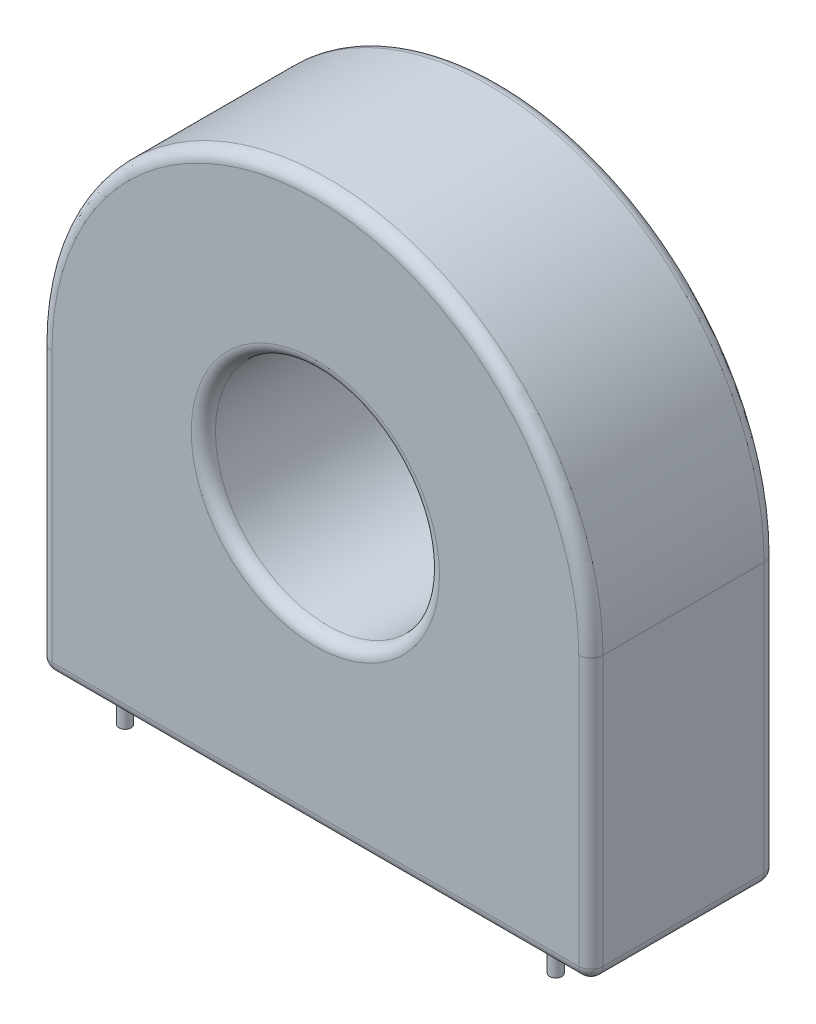
from build123d import *

# Parameters (mm, degrees)
SKETCH1_R           = 9.25
BOSS_EXTRUDE1_DEPTH = 7.65
SKETCH2_R           = 0.5
BOSS_EXTRUDE2_DEPTH = 2.5
FILLET1_R           = 1
SKETCH3_W           = 0.895944424
SKETCH3_H           = 4
SKETCH3_W_2         = 1.965215774
SKETCH3_H_2         = 0.500882695
CUT_EXTRUDE1_DEPTH  = 0.01
SKETCH4_W           = 0.682539037
SKETCH4_H           = 0.809522518
SKETCH4_H_2         = 0.809522517
CUT_EXTRUDE2_DEPTH  = 0.01


with BuildPart() as part:
    # Sketch1 → Boss-Extrude1 (new, symmetric)
    with BuildSketch(Plane.XY):
        with BuildLine():
            Line((-22.75, 11.625), (-22.75, -11.625))
            Line((-22.75, -11.625), (22.75, -11.625))
            Line((22.75, -11.625), (22.75, 11.625))
            ThreePointArc((22.75, 11.625), (0, 34.375), (-22.75, 11.625))
        make_face()
        with Locations((0, 11.625)):
            Circle(SKETCH1_R, mode=Mode.SUBTRACT)
    extrude(amount=BOSS_EXTRUDE1_DEPTH, both=True)

    # Sketch2 → Boss-Extrude2 (add, symmetric)
    with BuildSketch(Plane.XZ.offset(11.625)):
        with Locations(Location((17.78, 5.58, 0), (0, 0, 90))):
            Circle(SKETCH2_R)
        with Locations(Location((0, -4.58, 0), (0, 0, 90))):
            Circle(SKETCH2_R)
        with Locations(Location((-17.78, 5.58, 0), (0, 0, 90))):
            Circle(SKETCH2_R)
    extrude(amount=BOSS_EXTRUDE2_DEPTH, both=True)

    # Fillet1
    fillet1_edges = [part.edges().sort_by_distance(p)[0] for p in [
        (-9.25, 11.625, 7.65),
        (-22.75, 0, 7.65),
        (0, -11.625, 7.65),
        (22.75, 0, 7.65),
        (0, -11.625, -7.65),
        (-22.75, 0, -7.65),
        (0, 34.375, -7.65),
        (22.75, 0, -7.65),
        (22.75, -11.625, 0),
        (-22.75, -11.625, 0),
        (0, 34.375, 7.65),
    ]]
    fillet(fillet1_edges, radius=FILLET1_R)

    # Sketch3 → Cut-Extrude1 (cut)
    # profile 1 of 17: a face of its own
    with BuildSketch(Plane.XY.offset(-7.65)):
        Polygon((-8.243385382, -3.852442817), (-9.139329806, -3.852442817), (-9.139329806, -0.943216627), (-11.623966601, -3.852442817), (-12.582009721, -3.852442817), (-12.582009721, 0.147557183), (-11.686065297, 0.147557183), (-11.686065297, -2.761482996), (-9.201445726, 0.147557183), (-8.243385382, 0.147557183), align=None)
    # profile 2 of 17: a face of its own
    with BuildSketch(Plane.XY.offset(-7.65)):
        with Locations((-7.393297629, -1.852442817)):
            Rectangle(SKETCH3_W, SKETCH3_H)
    # profile 3 of 17: a face of its own
    with BuildSketch(Plane.XY.offset(-7.65)):
        Polygon((-2.768958574, -3.852441956), (-6.834476962, -3.852441956), (-6.834476962, -3.351560122), (-3.664902998, -3.351560122), (-3.664902998, 0.147557183), (-2.768958574, 0.147557183), align=None)
    # profile 4 of 17: a face of its own
    with BuildSketch(Plane.XY.offset(-7.65)):
        with Locations((-0.282186518, -1.852442817)):
            Rectangle(SKETCH3_W, SKETCH3_H)
    # profile 5 of 17: a face of its own
    with BuildSketch(Plane.XY.offset(-7.65)):
        Polygon((5.244161293, -3.852442817), (4.329861111, -3.852442817), (3.769090333, -2.723695022), (1.66010458, -2.723695022), (1.099333802, -3.852442817), (0.18503362, -3.852442817), (2.19649402, 0.147557183), (3.232700893, 0.147557183), align=None)
        Polygon((3.506990947, -2.222812327), (2.714597456, -0.642503409), (1.922203965, -2.222812327), align=None, mode=Mode.SUBTRACT)
    # profile 6 of 17: a face of its own
    with BuildSketch(Plane.XY.offset(-7.65)):
        Polygon((9.590829785, -3.852442817), (8.694885362, -3.852442817), (8.694885362, -1.877134176), (6.14814987, -1.877134176), (6.14814987, -3.852442817), (5.252205447, -3.852442817), (5.252205447, 0.147557183), (6.14814987, 0.147557183), (6.14814987, -1.37625148), (8.694885362, -1.37625148), (8.694885362, 0.147557183), (9.590829785, 0.147557183), align=None)
    # profile 7 of 17: a face of its own
    with BuildSketch(Plane.XY.offset(-7.65)):
        Polygon((14.532518498, -0.353325513), (12.582011443, -0.353325513), (12.582011443, -3.852442817), (11.686067881, -3.852442817), (11.686067881, -0.353325513), (9.735560826, -0.353325513), (9.735560826, 0.147557183), (14.532518498, 0.147557183), align=None)
    # profile 8 of 17: a face of its own
    with BuildSketch(Plane.XY.offset(-7.65)):
        with BuildLine():
            add(Edge.make_bspline(
                [(-14.092768959, -8.387409611), (-14.093682359, -8.416798847), (-14.095444674, -8.473502486), (-14.107040039, -8.555298605), (-14.125683506, -8.631229451), (-14.151024529, -8.701754478), (-14.183558361, -8.767078187), (-14.224942542, -8.825300742), (-14.271907298, -8.879214637), (-14.326767489, -8.926585214), (-14.38808482, -8.967933996), (-14.454750326, -9.004373318), (-14.52729125, -9.03541708), (-14.606060265, -9.059642085), (-14.69033939, -9.079109265), (-14.780196049, -9.093183874), (-14.875991171, -9.100984664), (-14.941667322, -9.101946627), (-14.975485009, -9.102441956)],
                knots=[0, 0, 0, 0, 1.091324182, 2.105602559, 3.061388645, 3.990302777, 4.883708783, 5.761913066, 6.63583257, 7.533363956, 8.444729669, 9.377803759, 10.351071984, 11.369571165, 12.434066396, 13.5611468, 14.744196001, 16, 16, 16, 16], degree=3))
            Line((-14.975485009, -9.102441956), (-16.973509493, -9.102441956))
            add(Edge.make_bspline(
                [(-16.973509493, -9.102441956), (-17.007103675, -9.101941333), (-17.072556098, -9.100965956), (-17.168128459, -9.093184015), (-17.25798513, -9.079109231), (-17.342264241, -9.05964209), (-17.421033297, -9.03541709), (-17.493574078, -9.004373278), (-17.560240087, -8.96793414), (-17.621555608, -8.926584691), (-17.676422367, -8.879216537), (-17.723363266, -8.825293838), (-17.76483693, -8.767104304), (-17.797071266, -8.701561929), (-17.823788355, -8.631435435), (-17.842083583, -8.555267841), (-17.853747393, -8.473757651), (-17.855521593, -8.417298834), (-17.85643739, -8.388156242)],
                knots=[0, 0, 0, 0, 1.248585623, 2.432652029, 3.560701514, 4.626112014, 5.645486916, 6.619591972, 7.553468334, 8.465617653, 9.36392075, 10.238591664, 11.11755104, 12.011725211, 12.945218025, 13.90182591, 14.916976379, 16, 16, 16, 16], degree=3))
            Line((-17.85643739, -8.388156242), (-17.856440834, -5.817603477))
            add(Edge.make_bspline(
                [(-17.856440834, -5.817603477), (-17.855523491, -5.788462915), (-17.853746238, -5.732006206), (-17.842083798, -5.650497895), (-17.8237883, -5.574330315), (-17.797071279, -5.504203818), (-17.764836926, -5.438661443), (-17.723363267, -5.380471908), (-17.676422367, -5.32654921), (-17.621555608, -5.279181056), (-17.560240087, -5.237831606), (-17.493574078, -5.201392469), (-17.421033297, -5.170348655), (-17.342264241, -5.146123665), (-17.257985128, -5.126656481), (-17.168128465, -5.112581873), (-17.072333344, -5.104781083), (-17.006657193, -5.10381912), (-16.972839506, -5.103323791)],
                knots=[0, 0, 0, 0, 1.082394717, 2.097023559, 3.053139899, 3.986153045, 4.879867752, 5.758375482, 6.632596953, 7.530438465, 8.442119083, 9.37551558, 10.3491201, 11.367971205, 12.432834253, 13.560304098, 14.743762081, 16, 16, 16, 16], degree=3))
            Line((-16.972839506, -5.103323791), (-14.975689966, -5.102442817))
            add(Edge.make_bspline(
                [(-14.975689966, -5.102442817), (-14.941806362, -5.10331105), (-14.876074911, -5.104995352), (-14.780194387, -5.11252725), (-14.690339799, -5.126669955), (-14.606060162, -5.146120303), (-14.527291275, -5.170349507), (-14.45475032, -5.201392218), (-14.388084821, -5.237831805), (-14.326767488, -5.279180519), (-14.271907299, -5.326551114), (-14.22494254, -5.380465004), (-14.183558371, -5.43868756), (-14.151024493, -5.504011269), (-14.12568365, -5.574536294), (-14.107039472, -5.65046715), (-14.095481961, -5.73201659), (-14.093692588, -5.788469804), (-14.092768959, -5.817609505)],
                knots=[0, 0, 0, 0, 1.259172173, 2.442692089, 3.570220939, 4.635139714, 5.654044138, 6.627699609, 7.561144954, 8.472873283, 9.370761781, 10.245029003, 11.123582708, 12.017344185, 12.946627916, 13.902794293, 14.917476233, 16, 16, 16, 16], degree=3))
            Line((-14.092768959, -5.817609505), (-14.092768959, -8.387409611))
        make_face()
        with BuildLine():
            Line((-14.921694844, -8.418002541), (-14.921694844, -5.787010546))
            add(Edge.make_bspline(
                [(-14.921694844, -5.787010546), (-14.922552419, -5.772712006), (-14.924186458, -5.745467314), (-14.936173859, -5.707682312), (-14.953640843, -5.675085245), (-14.978500578, -5.648802462), (-15.009079361, -5.628002708), (-15.046310566, -5.614310691), (-15.089384151, -5.605145539), (-15.120343035, -5.604532632), (-15.13686067, -5.604205625)],
                knots=[0, 0, 0, 0, 1.068687892, 2.03629688, 2.942648866, 3.814683618, 4.718091592, 5.68670121, 6.765775135, 8, 8, 8, 8], degree=3))
            Line((-15.13686067, -5.604205625), (-16.811524126, -5.603325513))
            add(Edge.make_bspline(
                [(-16.811524126, -5.603325513), (-16.82802163, -5.604015565), (-16.858944314, -5.60530899), (-16.902236935, -5.614455591), (-16.939920748, -5.627778683), (-16.970720504, -5.648813863), (-16.995487187, -5.675102237), (-17.013313351, -5.707522083), (-17.023699745, -5.7458961), (-17.02619132, -5.773161473), (-17.027513228, -5.787627142)],
                knots=[0, 0, 0, 0, 1.229193561, 2.303982665, 3.289199236, 4.189019928, 5.057591977, 5.960344992, 6.917859159, 8, 8, 8, 8], degree=3))
            Line((-17.027513228, -5.787627142), (-17.02751495, -8.418002541))
            add(Edge.make_bspline(
                [(-17.02751495, -8.418002541), (-17.02619583, -8.432514035), (-17.023713126, -8.459826005), (-17.01331298, -8.498243414), (-16.995487323, -8.530664262), (-16.970720311, -8.556949177), (-16.939921439, -8.577998001), (-16.902234004, -8.591263307), (-16.858955334, -8.600660893), (-16.827986688, -8.60124727), (-16.811463845, -8.601560122)],
                knots=[0, 0, 0, 0, 1.085029602, 2.042125889, 2.944484921, 3.812677906, 4.712105896, 5.696892497, 6.771212539, 8, 8, 8, 8], degree=3))
            Line((-16.811463845, -8.601560122), (-15.137675333, -8.601560122))
            add(Edge.make_bspline(
                [(-15.137675333, -8.601560122), (-15.120884586, -8.601250355), (-15.089651388, -8.600674144), (-15.046310398, -8.591455672), (-15.009079392, -8.577762891), (-14.978500598, -8.55696333), (-14.953640732, -8.530680458), (-14.936174313, -8.498083577), (-14.924122164, -8.460101229), (-14.922532857, -8.432645352), (-14.921694844, -8.418002541)],
                knots=[0, 0, 0, 0, 1.248967675, 2.323258931, 3.287575479, 4.186979369, 5.05514909, 5.957483945, 6.920804297, 8, 8, 8, 8], degree=3))
        make_face(mode=Mode.SUBTRACT)
    # profile 9 of 17: a face of its own
    with BuildSketch(Plane.XY.offset(-7.65)):
        with BuildLine():
            add(Edge.make_bspline(
                [(-10.091358025, -8.387409611), (-10.092271424, -8.416798847), (-10.094033739, -8.473502486), (-10.105629104, -8.555298605), (-10.124272571, -8.631229451), (-10.149613594, -8.701754478), (-10.182147427, -8.767078187), (-10.223531608, -8.825300742), (-10.270496363, -8.879214637), (-10.325356554, -8.926585214), (-10.386673885, -8.967933996), (-10.453339391, -9.004373318), (-10.525880315, -9.03541708), (-10.60464933, -9.059642085), (-10.688928455, -9.079109265), (-10.778785114, -9.093183874), (-10.874580236, -9.100984664), (-10.940256387, -9.101946627), (-10.974074074, -9.102441956)],
                knots=[0, 0, 0, 0, 1.091324182, 2.105602559, 3.061388645, 3.990302777, 4.883708783, 5.761913066, 6.63583257, 7.533363956, 8.444729669, 9.377803759, 10.351071984, 11.369571165, 12.434066396, 13.5611468, 14.744196001, 16, 16, 16, 16], degree=3))
            Line((-10.974074074, -9.102441956), (-12.972098559, -9.102441956))
            add(Edge.make_bspline(
                [(-12.972098559, -9.102441956), (-13.00569274, -9.101941333), (-13.071145163, -9.100965956), (-13.166717524, -9.093184015), (-13.256574195, -9.079109231), (-13.340853306, -9.05964209), (-13.419622363, -9.03541709), (-13.492163143, -9.004373278), (-13.558829153, -8.96793414), (-13.620144673, -8.926584691), (-13.675011432, -8.879216537), (-13.721952331, -8.825293838), (-13.763425995, -8.767104304), (-13.795660331, -8.701561929), (-13.82237742, -8.631435435), (-13.840672649, -8.555267841), (-13.852336458, -8.473757651), (-13.854110658, -8.417298834), (-13.855026455, -8.388156242)],
                knots=[0, 0, 0, 0, 1.248585623, 2.432652029, 3.560701514, 4.626112014, 5.645486916, 6.619591972, 7.553468334, 8.465617653, 9.36392075, 10.238591664, 11.11755104, 12.011725211, 12.945218025, 13.90182591, 14.916976379, 16, 16, 16, 16], degree=3))
            Line((-13.855026455, -8.388156242), (-13.8550299, -5.817603477))
            add(Edge.make_bspline(
                [(-13.8550299, -5.817603477), (-13.854112557, -5.788462915), (-13.852335303, -5.732006206), (-13.840672863, -5.650497895), (-13.822377366, -5.574330315), (-13.795660345, -5.504203818), (-13.763425991, -5.438661443), (-13.721952332, -5.380471908), (-13.675011432, -5.32654921), (-13.620144673, -5.279181056), (-13.558829153, -5.237831606), (-13.492163143, -5.201392469), (-13.419622363, -5.170348655), (-13.340853307, -5.146123665), (-13.256574193, -5.126656481), (-13.16671753, -5.112581873), (-13.070922409, -5.104781083), (-13.005246258, -5.10381912), (-12.971428571, -5.103323791)],
                knots=[0, 0, 0, 0, 1.082394717, 2.097023559, 3.053139899, 3.986153045, 4.879867752, 5.758375482, 6.632596953, 7.530438465, 8.442119083, 9.37551558, 10.3491201, 11.367971205, 12.432834253, 13.560304098, 14.743762081, 16, 16, 16, 16], degree=3))
            Line((-12.971428571, -5.103323791), (-10.974279032, -5.102442817))
            add(Edge.make_bspline(
                [(-10.974279032, -5.102442817), (-10.940395427, -5.10331105), (-10.874663976, -5.104995352), (-10.778783452, -5.11252725), (-10.688928865, -5.126669955), (-10.604649228, -5.146120303), (-10.52588034, -5.170349507), (-10.453339385, -5.201392218), (-10.386673887, -5.237831805), (-10.325356553, -5.279180519), (-10.270496364, -5.326551114), (-10.223531605, -5.380465004), (-10.182147436, -5.43868756), (-10.149613558, -5.504011269), (-10.124272715, -5.574536294), (-10.105628537, -5.65046715), (-10.094071026, -5.73201659), (-10.092281653, -5.788469804), (-10.091358025, -5.817609505)],
                knots=[0, 0, 0, 0, 1.259172173, 2.442692089, 3.570220939, 4.635139714, 5.654044138, 6.627699609, 7.561144954, 8.472873283, 9.370761781, 10.245029003, 11.123582708, 12.017344185, 12.946627916, 13.902794293, 14.917476233, 16, 16, 16, 16], degree=3))
            Line((-10.091358025, -5.817609505), (-10.091358025, -8.387409611))
        make_face()
        with BuildLine():
            Line((-10.920283909, -8.418002541), (-10.920283909, -5.787010546))
            add(Edge.make_bspline(
                [(-10.920283909, -5.787010546), (-10.921141484, -5.772712006), (-10.922775523, -5.745467314), (-10.934762925, -5.707682312), (-10.952229908, -5.675085245), (-10.977089643, -5.648802462), (-11.007668426, -5.628002708), (-11.044899632, -5.614310691), (-11.087973216, -5.605145539), (-11.1189321, -5.604532632), (-11.135449735, -5.604205625)],
                knots=[0, 0, 0, 0, 1.068687892, 2.03629688, 2.942648866, 3.814683618, 4.718091592, 5.68670121, 6.765775135, 8, 8, 8, 8], degree=3))
            Line((-11.135449735, -5.604205625), (-12.810113192, -5.603325513))
            add(Edge.make_bspline(
                [(-12.810113192, -5.603325513), (-12.826610696, -5.604015565), (-12.857533379, -5.60530899), (-12.900826, -5.614455591), (-12.938509813, -5.627778683), (-12.969309569, -5.648813863), (-12.994076253, -5.675102237), (-13.011902417, -5.707522083), (-13.02228881, -5.7458961), (-13.024780385, -5.773161473), (-13.026102293, -5.787627142)],
                knots=[0, 0, 0, 0, 1.229193561, 2.303982665, 3.289199236, 4.189019928, 5.057591977, 5.960344992, 6.917859159, 8, 8, 8, 8], degree=3))
            Line((-13.026102293, -5.787627142), (-13.026104015, -8.418002541))
            add(Edge.make_bspline(
                [(-13.026104015, -8.418002541), (-13.024784896, -8.432514035), (-13.022302191, -8.459826005), (-13.011902045, -8.498243414), (-12.994076389, -8.530664262), (-12.969309376, -8.556949177), (-12.938510504, -8.577998001), (-12.900823069, -8.591263307), (-12.857544399, -8.600660893), (-12.826575753, -8.60124727), (-12.81005291, -8.601560122)],
                knots=[0, 0, 0, 0, 1.085029602, 2.042125889, 2.944484921, 3.812677906, 4.712105896, 5.696892497, 6.771212539, 8, 8, 8, 8], degree=3))
            Line((-12.81005291, -8.601560122), (-11.136264399, -8.601560122))
            add(Edge.make_bspline(
                [(-11.136264399, -8.601560122), (-11.119473651, -8.601250355), (-11.088240453, -8.600674144), (-11.044899463, -8.591455672), (-11.007668457, -8.577762891), (-10.977089664, -8.55696333), (-10.952229797, -8.530680458), (-10.934763379, -8.498083577), (-10.922711229, -8.460101229), (-10.921121922, -8.432645352), (-10.920283909, -8.418002541)],
                knots=[0, 0, 0, 0, 1.248967675, 2.323258931, 3.287575479, 4.186979369, 5.05514909, 5.957483945, 6.920804297, 8, 8, 8, 8], degree=3))
        make_face(mode=Mode.SUBTRACT)
    # profile 10 of 17: a face of its own
    with BuildSketch(Plane.XY.offset(-7.65)):
        Polygon((-6.747720493, -5.603325513), (-7.839507034, -5.603325513), (-7.839507034, -9.102442817), (-8.668432919, -9.102442817), (-8.668432919, -5.102442817), (-6.747720493, -5.102442817), align=None)
    # profile 11 of 17: a face of its own
    with BuildSketch(Plane.XY.offset(-7.65)):
        with Locations((-4.929806858, -7.441066726)):
            Rectangle(SKETCH3_W_2, SKETCH3_H_2)
    # profile 12 of 17: a face of its own
    with BuildSketch(Plane.XY.offset(-7.65)):
        with BuildLine():
            Line((-0.062433862, -9.102441956), (-2.943174396, -9.102441956))
            add(Edge.make_bspline(
                [(-2.943174396, -9.102441956), (-2.976768578, -9.101941333), (-3.042221001, -9.100965956), (-3.13779336, -9.093184015), (-3.227650038, -9.079109233), (-3.311929126, -9.059642082), (-3.390698265, -9.03541712), (-3.463238756, -9.004373172), (-3.529905784, -8.967934513), (-3.59121764, -8.926583343), (-3.646097698, -8.879221432), (-3.692990291, -8.825276058), (-3.734798666, -8.766957424), (-3.766268277, -8.701062772), (-3.793842135, -8.630980299), (-3.811573222, -8.554628837), (-3.823449348, -8.472886893), (-3.82519911, -8.416420771), (-3.826102293, -8.387274408)],
                knots=[0, 0, 0, 0, 1.247794276, 2.431110226, 3.558444758, 4.623180007, 5.641908834, 6.615396507, 7.548680983, 8.460252186, 9.357985943, 10.232102494, 11.11050479, 12.013864952, 12.936550513, 13.903155723, 14.917662794, 16, 16, 16, 16], degree=3))
            Line((-3.826102293, -8.387274408), (-3.826105737, -7.342130352))
            add(Edge.make_bspline(
                [(-3.826105737, -7.342130352), (-3.825194362, -7.313042769), (-3.823427062, -7.25663736), (-3.811620081, -7.174927589), (-3.793616474, -7.098392458), (-3.76672072, -7.028017), (-3.734505794, -6.962470097), (-3.693027214, -6.904281387), (-3.646087186, -6.850359776), (-3.59122188, -6.802986296), (-3.529899461, -6.76165761), (-3.463260618, -6.725137721), (-3.390529258, -6.694379354), (-3.31210164, -6.668858204), (-3.227716144, -6.649313706), (-3.137655444, -6.636986831), (-3.042063706, -6.627305701), (-2.976335586, -6.626609714), (-2.942504409, -6.62625148)],
                knots=[0, 0, 0, 0, 1.079603584, 2.093521595, 3.059565557, 3.99192505, 4.885013636, 5.762905899, 6.636514906, 7.533727405, 8.444769315, 9.377511891, 10.350434321, 11.371899559, 12.436016582, 13.561057118, 14.74464218, 16, 16, 16, 16], degree=3))
            Line((-2.942504409, -6.62625148), (-0.891359747, -6.62625148))
            Line((-0.891359747, -6.62625148), (-0.891359747, -5.603325513))
            Line((-0.891359747, -5.603325513), (-3.605051257, -5.603325513))
            Line((-3.605051257, -5.603325513), (-3.605051257, -5.102442817))
            Line((-3.605051257, -5.102442817), (-0.062433862, -5.102442817))
            Line((-0.062433862, -5.102442817), (-0.062433862, -7.127134176))
            Line((-0.062433862, -7.127134176), (-2.781189029, -7.127134176))
            add(Edge.make_bspline(
                [(-2.781189029, -7.127134176), (-2.797679997, -7.127833524), (-2.82859041, -7.129144371), (-2.871963862, -7.138180282), (-2.909228473, -7.151811502), (-2.940980804, -7.171619732), (-2.964826556, -7.198943809), (-2.983041164, -7.231267482), (-2.993346074, -7.269724557), (-2.995849785, -7.29697756), (-2.997178131, -7.311436665)],
                knots=[0, 0, 0, 0, 1.228569347, 2.302811313, 3.287526345, 4.174798407, 5.059089855, 5.961383309, 6.918410039, 8, 8, 8, 8], degree=3))
            Line((-2.997178131, -7.311436665), (-2.997179853, -8.417253326))
            add(Edge.make_bspline(
                [(-2.997179853, -8.417253326), (-2.995852085, -8.431715422), (-2.993349562, -8.458972994), (-2.983029314, -8.497407893), (-2.964868248, -8.529812795), (-2.940719274, -8.556964482), (-2.909540764, -8.577956677), (-2.871912747, -8.591275855), (-2.828616048, -8.600657094), (-2.797650133, -8.601245948), (-2.781128748, -8.601560122)],
                knots=[0, 0, 0, 0, 1.080018298, 2.035574722, 2.936481959, 3.819414846, 4.717395756, 5.700597943, 6.773189523, 8, 8, 8, 8], degree=3))
            Line((-2.781128748, -8.601560122), (-0.062433862, -8.601560122))
            Line((-0.062433862, -8.601560122), (-0.062433862, -9.102441956))
        make_face()
    # profile 13 of 17: a face of its own
    with BuildSketch(Plane.XY.offset(-7.65)):
        with Locations((1.09770637, -7.441066726)):
            Rectangle(SKETCH3_W_2, SKETCH3_H_2)
    # profile 14 of 17: a face of its own
    with BuildSketch(Plane.XY.offset(-7.65)):
        with BuildLine():
            add(Edge.make_bspline(
                [(5.965079365, -8.386535527), (5.964178551, -8.415925924), (5.962440446, -8.4726342), (5.95063423, -8.554660449), (5.932548182, -8.630769718), (5.906361096, -8.701259807), (5.874585792, -8.766930613), (5.832868082, -8.825283111), (5.785951405, -8.87921949), (5.731077978, -8.926583878), (5.669764295, -8.967934365), (5.603097775, -9.004373214), (5.530557139, -9.03541711), (5.451788042, -9.059642076), (5.36750894, -9.079109267), (5.277652274, -9.093183873), (5.181857154, -9.100984664), (5.116181002, -9.101946627), (5.082363316, -9.102441956)],
                knots=[0, 0, 0, 0, 1.090546724, 2.104191533, 3.069975193, 3.988060192, 4.890652559, 5.768308273, 6.641681885, 7.538652629, 8.449449058, 9.381940305, 10.354600579, 11.372463556, 12.436293852, 13.562670226, 14.744980438, 16, 16, 16, 16], degree=3))
            Line((5.082363316, -9.102441956), (3.084338831, -9.102441956))
            add(Edge.make_bspline(
                [(3.084338831, -9.102441956), (3.050744649, -9.101941333), (2.985292226, -9.100965956), (2.889719867, -9.093184015), (2.79986319, -9.079109233), (2.715584102, -9.059642082), (2.636814963, -9.03541712), (2.564274471, -9.004373172), (2.497607443, -8.967934513), (2.436295588, -8.926583343), (2.38141553, -8.879221432), (2.334522937, -8.825276058), (2.292714561, -8.766957424), (2.261244951, -8.701062772), (2.233671092, -8.630980299), (2.215940006, -8.554628837), (2.204063879, -8.472886893), (2.202314117, -8.416420771), (2.201410935, -8.387274408)],
                knots=[0, 0, 0, 0, 1.247794276, 2.431110226, 3.558444758, 4.623180007, 5.641908834, 6.615396507, 7.548680983, 8.460252186, 9.357985943, 10.232102494, 11.11050479, 12.013864952, 12.936550513, 13.903155723, 14.917662794, 16, 16, 16, 16], degree=3))
            Line((2.201410935, -8.387274408), (2.20140749, -7.342130352))
            add(Edge.make_bspline(
                [(2.20140749, -7.342130352), (2.202318865, -7.313042769), (2.204086166, -7.25663736), (2.215893147, -7.174927589), (2.233896753, -7.098392458), (2.260792507, -7.028017), (2.293007433, -6.962470097), (2.334486014, -6.904281387), (2.381426042, -6.850359776), (2.436291347, -6.802986296), (2.497613766, -6.76165761), (2.564252609, -6.725137721), (2.636983969, -6.694379354), (2.715411588, -6.668858204), (2.799797083, -6.649313706), (2.889857784, -6.636986831), (2.985449521, -6.627305701), (3.051177641, -6.626609714), (3.085008818, -6.62625148)],
                knots=[0, 0, 0, 0, 1.079603584, 2.093521595, 3.059565557, 3.99192505, 4.885013636, 5.762905899, 6.636514906, 7.533727405, 8.444769315, 9.377511891, 10.350434321, 11.371899559, 12.436016582, 13.561057118, 14.74464218, 16, 16, 16, 16], degree=3))
            Line((3.085008818, -6.62625148), (5.13615348, -6.62625148))
            Line((5.13615348, -6.62625148), (5.13615348, -6.037295593))
            add(Edge.make_bspline(
                [(5.13615348, -6.037295593), (5.134669543, -6.003911441), (5.131863069, -5.940774166), (5.109887248, -5.851914284), (5.071662187, -5.775539215), (5.016131625, -5.713430919), (4.945922492, -5.664285665), (4.860067415, -5.630843446), (4.760163091, -5.608269116), (4.688325623, -5.60561293), (4.65026455, -5.604205625)],
                knots=[0, 0, 0, 0, 1.078341341, 2.039396853, 2.936100315, 3.811247336, 4.704924793, 5.680758394, 6.771214737, 8, 8, 8, 8], degree=3))
            Line((4.65026455, -5.604205625), (2.477723008, -5.603325513))
            Line((2.477723008, -5.603325513), (2.477723008, -5.102442817))
            Line((2.477723008, -5.102442817), (4.866177869, -5.102442817))
            add(Edge.make_bspline(
                [(4.866177869, -5.102442817), (4.908269619, -5.103563399), (4.990162799, -5.105743589), (5.109341208, -5.114696909), (5.221051232, -5.132427713), (5.325501701, -5.157485777), (5.423722659, -5.187375359), (5.513734389, -5.226680498), (5.597083234, -5.271836678), (5.672845167, -5.32471404), (5.741022297, -5.384413088), (5.800067642, -5.451821757), (5.851043602, -5.526016104), (5.890766339, -5.608882975), (5.924528279, -5.697668163), (5.946261716, -5.794495207), (5.962237991, -5.897924134), (5.964114467, -5.969511356), (5.965079365, -6.006322027)],
                knots=[0, 0, 0, 0, 1.248360097, 2.428793654, 3.540639795, 4.597573295, 5.611896563, 6.58001487, 7.504387576, 8.418265567, 9.313545441, 10.184224061, 11.068921664, 11.973149494, 12.902398245, 13.878991678, 14.90936207, 16, 16, 16, 16], degree=3))
            Line((5.965079365, -6.006322027), (5.965079365, -8.386535527))
        make_face()
        with BuildLine():
            Line((5.13615348, -8.417253326), (5.13615348, -7.127134176))
            Line((5.13615348, -7.127134176), (3.246324198, -7.127134176))
            add(Edge.make_bspline(
                [(3.246324198, -7.127134176), (3.229833231, -7.127833524), (3.198922817, -7.129144371), (3.155549365, -7.138180282), (3.118284754, -7.151811502), (3.086532423, -7.171619732), (3.062686671, -7.198943809), (3.044472063, -7.231267482), (3.034167153, -7.269724557), (3.031663443, -7.29697756), (3.030335097, -7.311436665)],
                knots=[0, 0, 0, 0, 1.228569347, 2.302811313, 3.287526345, 4.174798407, 5.059089855, 5.961383309, 6.918410039, 8, 8, 8, 8], degree=3))
            Line((3.030335097, -7.311436665), (3.030333375, -8.417253326))
            add(Edge.make_bspline(
                [(3.030333375, -8.417253326), (3.031661142, -8.431715422), (3.034163665, -8.458972994), (3.044483913, -8.497407893), (3.062644979, -8.529812795), (3.086793953, -8.556964482), (3.117972463, -8.577956677), (3.155600481, -8.591275855), (3.19889718, -8.600657094), (3.229863094, -8.601245948), (3.24638448, -8.601560122)],
                knots=[0, 0, 0, 0, 1.080018298, 2.035574722, 2.936481959, 3.819414846, 4.717395756, 5.700597943, 6.773189523, 8, 8, 8, 8], degree=3))
            Line((3.24638448, -8.601560122), (4.920172991, -8.601560122))
            add(Edge.make_bspline(
                [(4.920172991, -8.601560122), (4.936962248, -8.601249004), (4.968192673, -8.600670281), (5.011551634, -8.591468092), (5.048724441, -8.577722577), (5.079681832, -8.556979089), (5.103925391, -8.529829418), (5.12172559, -8.497248415), (5.133711047, -8.459205719), (5.135310243, -8.431758791), (5.13615348, -8.417253326)],
                knots=[0, 0, 0, 0, 1.246449489, 2.318574743, 3.280947022, 4.178537522, 5.061086541, 5.961602094, 6.922980187, 8, 8, 8, 8], degree=3))
        make_face(mode=Mode.SUBTRACT)
    # profile 15 of 17: a face of its own
    with BuildSketch(Plane.XY.offset(-7.65)):
        Polygon((9.988555101, -5.603325513), (7.149910094, -5.603325513), (9.060536541, -9.102442817), (8.132517981, -9.102442817), (6.253964809, -5.603325513), (6.253964809, -5.102442817), (9.988555101, -5.102442817), align=None)
    # profile 16 of 17: a face of its own
    with BuildSketch(Plane.XY.offset(-7.65)):
        Polygon((13.685714286, -9.102441956), (10.018143395, -9.102441956), (10.018143395, -8.601560122), (12.856788401, -8.601560122), (12.856788401, -5.102442817), (13.685714286, -5.102442817), align=None)
    # profile 17 of 17: a face of its own
    with BuildSketch(Plane.XY.offset(-7.65)):
        Polygon((18.07948547, -5.603325513), (16.332627005, -5.603325513), (16.332627005, -9.102442817), (15.50370112, -9.102442817), (15.50370112, -5.603325513), (13.756842655, -5.603325513), (13.756842655, -5.102442817), (18.07948547, -5.102442817), align=None)
    extrude(amount=CUT_EXTRUDE1_DEPTH, mode=Mode.SUBTRACT)

    # Sketch4 → Cut-Extrude2 (cut)
    # profile 1 of 6: a face of its own
    with BuildSketch(Plane.XZ.offset(11.625)):
        with BuildLine():
            Line((-17.977955234, 3.785665694), (-20.470002579, 3.785665694))
            Line((-20.470002579, 3.785665694), (-20.470002579, 3.410004318))
            Line((-20.470002579, 3.410004318), (-18.522911986, 3.410004318))
            Line((-18.522911986, 3.410004318), (-18.522911986, 2.442393641))
            add(Edge.make_bspline(
                [(-18.522911986, 2.442393641), (-18.523662632, 2.431330693), (-18.525062188, 2.410704172), (-18.532348559, 2.381898417), (-18.544234787, 2.357674062), (-18.560672003, 2.337919704), (-18.581005577, 2.322030697), (-18.606201681, 2.311858475), (-18.635197547, 2.304890863), (-18.656028186, 2.304429461), (-18.667100277, 2.304184213)],
                knots=[0, 0, 0, 0, 1.168383886, 2.178415151, 3.114761772, 3.990479347, 4.869897153, 5.80768764, 6.834722204, 8, 8, 8, 8], degree=3))
            Line((-18.667100277, 2.304184213), (-19.888988582, 2.304184858))
            add(Edge.make_bspline(
                [(-19.888988582, 2.304184858), (-19.911388772, 2.303913138), (-19.954860271, 2.303385817), (-20.017868855, 2.296194587), (-20.077248979, 2.286727695), (-20.132730361, 2.272402718), (-20.18416234, 2.252852298), (-20.232005362, 2.229664337), (-20.276380349, 2.20280682), (-20.316615169, 2.171332708), (-20.352362455, 2.135567208), (-20.38379617, 2.095465719), (-20.410571058, 2.050933071), (-20.431212773, 2.001442532), (-20.448927781, 1.948540897), (-20.460190982, 1.890950388), (-20.46870481, 1.829566741), (-20.469567241, 1.787021412), (-20.47001033, 1.765163048)],
                knots=[0, 0, 0, 0, 1.188285322, 2.306076078, 3.362203406, 4.378287727, 5.341092893, 6.277876351, 7.197026917, 8.088882973, 8.98250288, 9.874358936, 10.787456248, 11.730866857, 12.715190664, 13.743331781, 14.840599528, 16, 16, 16, 16], degree=3))
            Line((-20.47001033, 1.765163048), (-20.470002579, 1.32406811))
            add(Edge.make_bspline(
                [(-20.470002579, 1.32406811), (-20.469563353, 1.302195471), (-20.468708707, 1.259635704), (-20.460190504, 1.198238161), (-20.448927902, 1.140647625), (-20.431212736, 1.087746019), (-20.410571093, 1.03825539), (-20.383796072, 0.993723059), (-20.352362807, 0.953620423), (-20.316613856, 0.917859191), (-20.276385305, 0.886369006), (-20.23198608, 0.859573627), (-20.184305432, 0.836179537), (-20.132584144, 0.817582945), (-20.077191415, 0.803328368), (-20.017986612, 0.792551309), (-19.954915294, 0.786777017), (-19.911599716, 0.786043132), (-19.889322499, 0.785665694)],
                knots=[0, 0, 0, 0, 1.160756192, 2.258598661, 3.287278292, 4.272117663, 5.216022406, 6.129597976, 7.021921163, 7.916009126, 8.808332313, 9.727964308, 10.665238429, 11.624484024, 12.641100546, 13.699789761, 14.817001044, 16, 16, 16, 16], degree=3))
            Line((-19.889322499, 0.785665694), (-18.159607485, 0.78566634))
            Line((-18.159607485, 0.78566634), (-18.159607485, 1.161328361))
            Line((-18.159607485, 1.161328361), (-19.78114043, 1.161328361))
            add(Edge.make_bspline(
                [(-19.78114043, 1.161328361), (-19.792329157, 1.16158698), (-19.813268247, 1.16207097), (-19.842601797, 1.168805574), (-19.867455066, 1.179970144), (-19.887971087, 1.195674155), (-19.904367896, 1.215494681), (-19.916406758, 1.239882171), (-19.923409323, 1.268768003), (-19.924909214, 1.289376062), (-19.92569816, 1.300215959)],
                knots=[0, 0, 0, 0, 1.175204619, 2.199330993, 3.14391349, 4.020841102, 4.89407896, 5.827774186, 6.857403133, 8, 8, 8, 8], degree=3))
            Line((-19.92569816, 1.300215959), (-19.925045827, 1.789033285))
            add(Edge.make_bspline(
                [(-19.925045827, 1.789033285), (-19.924544547, 1.79986403), (-19.923589875, 1.820490854), (-19.916203781, 1.849438678), (-19.904578802, 1.874238348), (-19.887949436, 1.894166243), (-19.867461374, 1.909882565), (-19.842599843, 1.921043329), (-19.81339251, 1.927751612), (-19.792580471, 1.928255177), (-19.781518266, 1.928522837)],
                knots=[0, 0, 0, 0, 1.137900938, 2.16709752, 3.121197092, 3.994068258, 4.870627628, 5.814813473, 6.838509792, 8, 8, 8, 8], degree=3))
            Line((-19.781518266, 1.928522837), (-18.55886137, 1.928522837))
            add(Edge.make_bspline(
                [(-18.55886137, 1.928522837), (-18.536729182, 1.928904128), (-18.493558818, 1.929647862), (-18.430631937, 1.935408335), (-18.371427114, 1.946185534), (-18.316034444, 1.960440107), (-18.264312956, 1.979036591), (-18.216633021, 2.002431097), (-18.172231221, 2.029224965), (-18.132011979, 2.060720614), (-18.096228458, 2.096461554), (-18.06504139, 2.13649113), (-18.037839154, 2.180549483), (-18.017584813, 2.229788875), (-17.999551643, 2.282354593), (-17.988520085, 2.339570131), (-17.979863979, 2.400706371), (-17.979035868, 2.443037678), (-17.978608213, 2.464898498)],
                knots=[0, 0, 0, 0, 1.178342751, 2.298439003, 3.359862066, 4.379103791, 5.340826441, 6.280520881, 7.202527636, 8.097155065, 8.993551826, 9.888179255, 10.794055488, 11.740397672, 12.716623759, 13.747959744, 14.836996782, 16, 16, 16, 16], degree=3))
            Line((-17.978608213, 2.464898498), (-17.977955234, 3.785665694))
        make_face()
    # profile 2 of 6: a face of its own
    with BuildSketch(Plane.XZ.offset(11.625)):
        Polygon((-15.272495139, 3.023761578), (-15.781121441, 3.023761578), (-15.781121441, 3.78566634), (-16.241439547, 3.78566634), (-16.241439547, 3.023761578), (-16.923978584, 3.023761578), (-16.923978584, 3.78566634), (-17.384297336, 3.78566634), (-17.384297336, 3.023761578), (-17.892923638, 3.023761578), (-17.892923638, 2.690427599), (-17.384297336, 2.690427599), (-17.384297336, 1.880905081), (-17.892923638, 1.880905081), (-17.892923638, 1.547571102), (-17.384297336, 1.547571102), (-17.384297336, 0.78566634), (-16.923978584, 0.78566634), (-16.923978584, 1.547571102), (-16.241439547, 1.547571102), (-16.241439547, 0.78566634), (-15.781121441, 0.78566634), (-15.781121441, 1.547571102), (-15.272495139, 1.547571102), (-15.272495139, 1.880905081), (-15.781121441, 1.880905081), (-15.781121441, 2.690427599), (-15.272495139, 2.690427599), align=None)
        with Locations((-16.582709066, 2.28566634)):
            Rectangle(SKETCH4_W, SKETCH4_H, mode=Mode.SUBTRACT)
    # profile 3 of 6: a face of its own
    with BuildSketch(Plane.XZ.offset(11.625)):
        Polygon((14.998388573, 1.161328361), (14.27177957, 1.161328361), (14.27177957, 3.78566634), (13.726822818, 3.78566634), (13.726822818, 0.78566634), (14.998388573, 0.78566634), align=None)
    # profile 4 of 6: a face of its own
    with BuildSketch(Plane.XZ.offset(11.625)):
        Polygon((18.162425496, 3.023761578), (17.653799194, 3.023761578), (17.653799194, 3.78566634), (17.193481088, 3.78566634), (17.193481088, 3.023761578), (16.510942051, 3.023761578), (16.510942051, 3.78566634), (16.050623299, 3.78566634), (16.050623299, 3.023761578), (15.541996997, 3.023761578), (15.541996997, 2.690427599), (16.050623299, 2.690427599), (16.050623299, 1.880905081), (15.541996997, 1.880905081), (15.541996997, 1.547571102), (16.050623299, 1.547571102), (16.050623299, 0.78566634), (16.510942051, 0.78566634), (16.510942051, 1.547571102), (17.193481088, 1.547571102), (17.193481088, 0.78566634), (17.653799194, 0.78566634), (17.653799194, 1.547571102), (18.162425496, 1.547571102), (18.162425496, 1.880905081), (17.653799194, 1.880905081), (17.653799194, 2.690427599), (18.162425496, 2.690427599), align=None)
        with Locations((16.852211569, 2.28566634)):
            Rectangle(SKETCH4_W, SKETCH4_H, mode=Mode.SUBTRACT)
    # profile 5 of 6: a face of its own
    with BuildSketch(Plane.XZ.offset(11.625)):
        with BuildLine():
            Line((0.068470519, -0.379493213), (-1.784382439, -0.379493213))
            add(Edge.make_bspline(
                [(-1.784382439, -0.379493213), (-1.806873855, -0.379761618), (-1.85043672, -0.380281483), (-1.913535932, -0.38748279), (-1.972916046, -0.396949737), (-2.02839739, -0.411274726), (-2.079829521, -0.430825053), (-2.127671997, -0.454013362), (-2.172048953, -0.480869618), (-2.212276659, -0.512348289), (-2.248050363, -0.548096859), (-2.279268389, -0.58811271), (-2.306247453, -0.632046778), (-2.32700778, -0.681081577), (-2.34458205, -0.733819548), (-2.355797817, -0.791190557), (-2.364412714, -0.852341249), (-2.365246702, -0.894670495), (-2.365677392, -0.91653025)],
                knots=[0, 0, 0, 0, 1.195173015, 2.314890322, 3.372837922, 4.3906735, 5.355138094, 6.293536131, 7.214270886, 8.107664086, 9.002824179, 9.896217379, 10.800843866, 11.735133181, 12.721153505, 13.751066659, 14.838601261, 16, 16, 16, 16], degree=3))
            Line((-2.365677392, -0.91653025), (-2.365669641, -1.584535169))
            add(Edge.make_bspline(
                [(-2.365669641, -1.584535169), (-2.364187967, -1.617000533), (-2.361398272, -1.678126278), (-2.346527644, -1.764152666), (-2.321824118, -1.838558768), (-2.286798166, -1.901362163), (-2.244270892, -1.952987001), (-2.198476054, -1.997161407), (-2.148578988, -2.033770202), (-2.112016281, -2.051326722), (-2.093851995, -2.060048769)],
                knots=[0, 0, 0, 0, 1.338248567, 2.519652672, 3.585454005, 4.553382934, 5.464210136, 6.331599572, 7.171141735, 8, 8, 8, 8], degree=3))
            add(Edge.make_bspline(
                [(-2.093851995, -2.060048769), (-2.112009075, -2.068778563), (-2.148557278, -2.086350677), (-2.198689738, -2.122930761), (-2.244249093, -2.16783698), (-2.286830318, -2.22007597), (-2.321654842, -2.283389471), (-2.346749032, -2.358318841), (-2.361260678, -2.444872432), (-2.364152293, -2.506422124), (-2.365677392, -2.538884748)],
                knots=[0, 0, 0, 0, 0.824792689, 1.660216872, 2.529624704, 3.443034264, 4.414115552, 5.474689096, 6.668097019, 8, 8, 8, 8], degree=3))
            Line((-2.365677392, -2.538884748), (-2.365669641, -2.841090797))
            add(Edge.make_bspline(
                [(-2.365669641, -2.841090797), (-2.365230415, -2.862963436), (-2.364375769, -2.905523203), (-2.355857566, -2.966920747), (-2.344594964, -3.024511283), (-2.326879798, -3.077412888), (-2.306238155, -3.126903517), (-2.279463134, -3.171435849), (-2.248029869, -3.211538485), (-2.212280918, -3.247299716), (-2.172052367, -3.278789901), (-2.127653142, -3.30558528), (-2.079972494, -3.328979371), (-2.028251206, -3.347575962), (-1.972858477, -3.361830539), (-1.913653674, -3.372607599), (-1.850582356, -3.37838189), (-1.807266778, -3.379115776), (-1.784989561, -3.379493213)],
                knots=[0, 0, 0, 0, 1.160756192, 2.258598661, 3.287278292, 4.272117663, 5.216022406, 6.129597976, 7.021921163, 7.916009126, 8.808332313, 9.727964308, 10.665238429, 11.624484024, 12.641100546, 13.699789761, 14.817001044, 16, 16, 16, 16], degree=3))
            Line((-1.784989561, -3.379493213), (0.068470519, -3.379492567))
            Line((0.068470519, -3.379492567), (0.068470519, -3.003830546))
            Line((0.068470519, -3.003830546), (-1.675391088, -3.003830546))
            add(Edge.make_bspline(
                [(-1.675391088, -3.003830546), (-1.686607282, -3.003550515), (-1.707785748, -3.003021759), (-1.737404184, -2.996464844), (-1.762501321, -2.985216682), (-1.782944681, -2.969275144), (-1.800112372, -2.949912598), (-1.812031164, -2.925240521), (-1.819088906, -2.896401534), (-1.820580591, -2.875786509), (-1.821365222, -2.864942949)],
                knots=[0, 0, 0, 0, 1.172495619, 2.213911402, 3.153694288, 4.026166056, 4.909860763, 5.838811697, 6.863208895, 8, 8, 8, 8], degree=3))
            Line((-1.821365222, -2.864942949), (-1.820712889, -2.376125623))
            add(Edge.make_bspline(
                [(-1.820712889, -2.376125623), (-1.820215882, -2.365291241), (-1.819269347, -2.344657492), (-1.811828012, -2.315756678), (-1.800328709, -2.290668301), (-1.782923228, -2.271202035), (-1.762507523, -2.255248522), (-1.737402214, -2.244004022), (-1.707940836, -2.237479452), (-1.686920914, -2.236926809), (-1.675862577, -2.23663607)],
                knots=[0, 0, 0, 0, 1.132583134, 2.156969924, 3.10661066, 3.99029639, 4.862759295, 5.802532633, 6.843937837, 8, 8, 8, 8], degree=3))
            Line((-1.675862577, -2.23663607), (-0.258503533, -2.23663607))
            Line((-0.258503533, -2.23663607), (-0.258503533, -1.860974049))
            Line((-0.258503533, -1.860974049), (-1.675391088, -1.860974049))
            add(Edge.make_bspline(
                [(-1.675391088, -1.860974049), (-1.686617569, -1.860716696), (-1.707815447, -1.860230761), (-1.737216907, -1.853406443), (-1.76265845, -1.843155087), (-1.782919736, -1.827028737), (-1.80012835, -1.807733409), (-1.811896286, -1.783225191), (-1.819179522, -1.754673663), (-1.820606687, -1.734258937), (-1.821365222, -1.723408557)],
                knots=[0, 0, 0, 0, 1.177167623, 2.222731914, 3.156821517, 4.032768801, 4.919983729, 5.852635165, 6.858680457, 8, 8, 8, 8], degree=3))
            Line((-1.821365222, -1.723408557), (-1.820712889, -0.893384686))
            add(Edge.make_bspline(
                [(-1.820712889, -0.893384686), (-1.82018456, -0.882761744), (-1.819169433, -0.862350923), (-1.812047265, -0.833700962), (-1.799875882, -0.809080688), (-1.783395346, -0.78899919), (-1.7622295, -0.773899926), (-1.737450519, -0.762464573), (-1.707926625, -0.756015024), (-1.686916016, -0.755451207), (-1.675862577, -0.755154589)],
                knots=[0, 0, 0, 0, 1.117053019, 2.146295154, 3.079639607, 3.985204058, 4.847889539, 5.792117174, 6.838458384, 8, 8, 8, 8], degree=3))
            Line((-1.675862577, -0.755154589), (0.068470519, -0.755154589))
            Line((0.068470519, -0.755154589), (0.068470519, -0.379493213))
        make_face()
    # profile 6 of 6: a face of its own
    with BuildSketch(Plane.XZ.offset(11.625)):
        Polygon((2.831837799, -1.141397329), (2.323211497, -1.141397329), (2.323211497, -0.379492567), (1.862893391, -0.379492567), (1.862893391, -1.141397329), (1.180354354, -1.141397329), (1.180354354, -0.379492567), (0.720035602, -0.379492567), (0.720035602, -1.141397329), (0.2114093, -1.141397329), (0.2114093, -1.474731309), (0.720035602, -1.474731309), (0.720035602, -2.284253826), (0.2114093, -2.284253826), (0.2114093, -2.617587806), (0.720035602, -2.617587806), (0.720035602, -3.379492567), (1.180354354, -3.379492567), (1.180354354, -2.617587806), (1.862893391, -2.617587806), (1.862893391, -3.379492567), (2.323211497, -3.379492567), (2.323211497, -2.617587806), (2.831837799, -2.617587806), (2.831837799, -2.284253826), (2.323211497, -2.284253826), (2.323211497, -1.474731309), (2.831837799, -1.474731309), align=None)
        with Locations((1.521623873, -1.879492568)):
            Rectangle(SKETCH4_W, SKETCH4_H_2, mode=Mode.SUBTRACT)
    extrude(amount=-CUT_EXTRUDE2_DEPTH, mode=Mode.SUBTRACT)


solid = part.part
